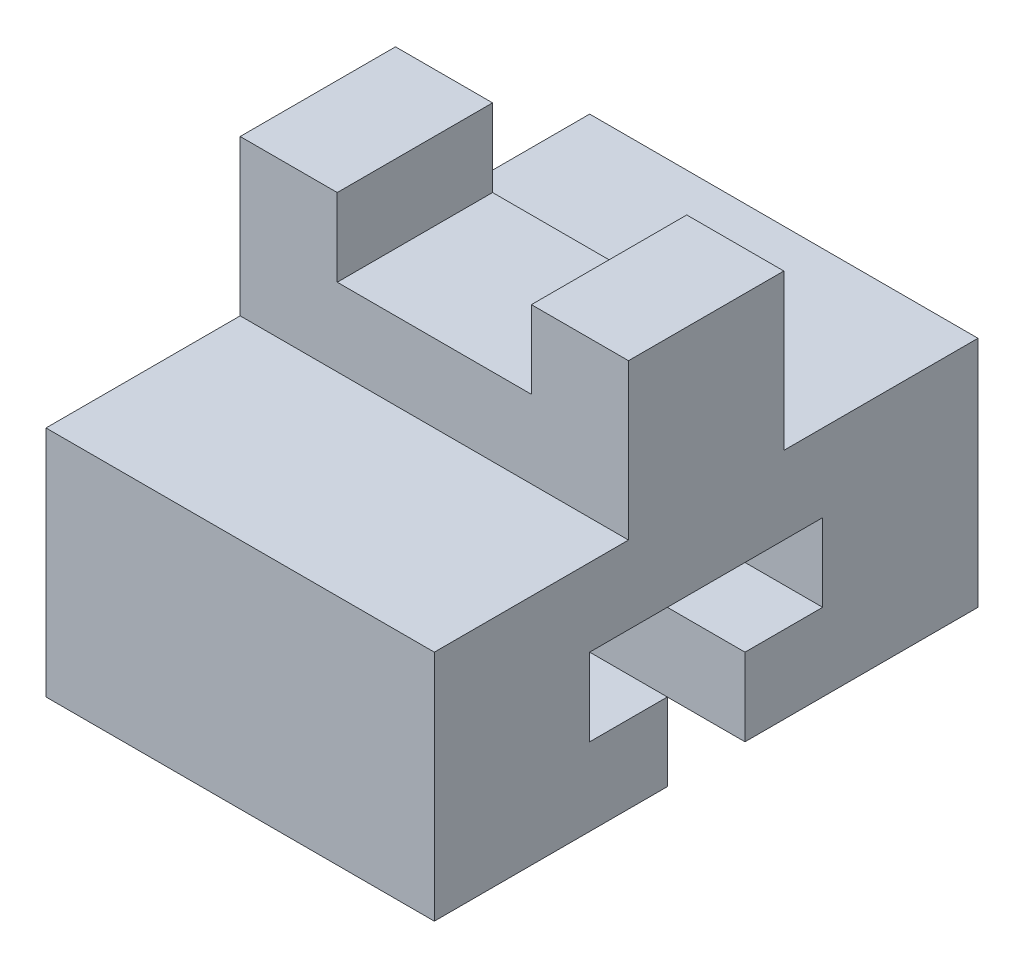
from build123d import *

# Parameters (mm, degrees)
BOSS_EXTRUDE1_DEPTH = 50
SKETCH2_W           = 25
SKETCH2_H           = 10
CUT_EXTRUDE1_DEPTH  = 84.815273071


with BuildPart() as part:
    # Sketch1 → Boss-Extrude1 (new body)
    with BuildSketch(Plane(origin=(0, 0, 0), x_dir=(0, 0, -1), z_dir=(1, 0, 0))):
        Polygon((0, 0), (30, 0), (30, 10), (20, 10), (20, 20), (50, 20), (50, 10), (40, 10), (40, 0), (70, 0), (70, 30), (45, 30), (45, 50), (25, 50), (25, 30), (0, 30), align=None)
    extrude(amount=-BOSS_EXTRUDE1_DEPTH)

    # Sketch2 → Cut-Extrude1 (cut, through all)
    with BuildSketch(Plane.XY.offset(-25)):
        with Locations((-25, 45)):
            Rectangle(SKETCH2_W, SKETCH2_H)
    extrude(amount=-CUT_EXTRUDE1_DEPTH, mode=Mode.SUBTRACT)


solid = part.part
